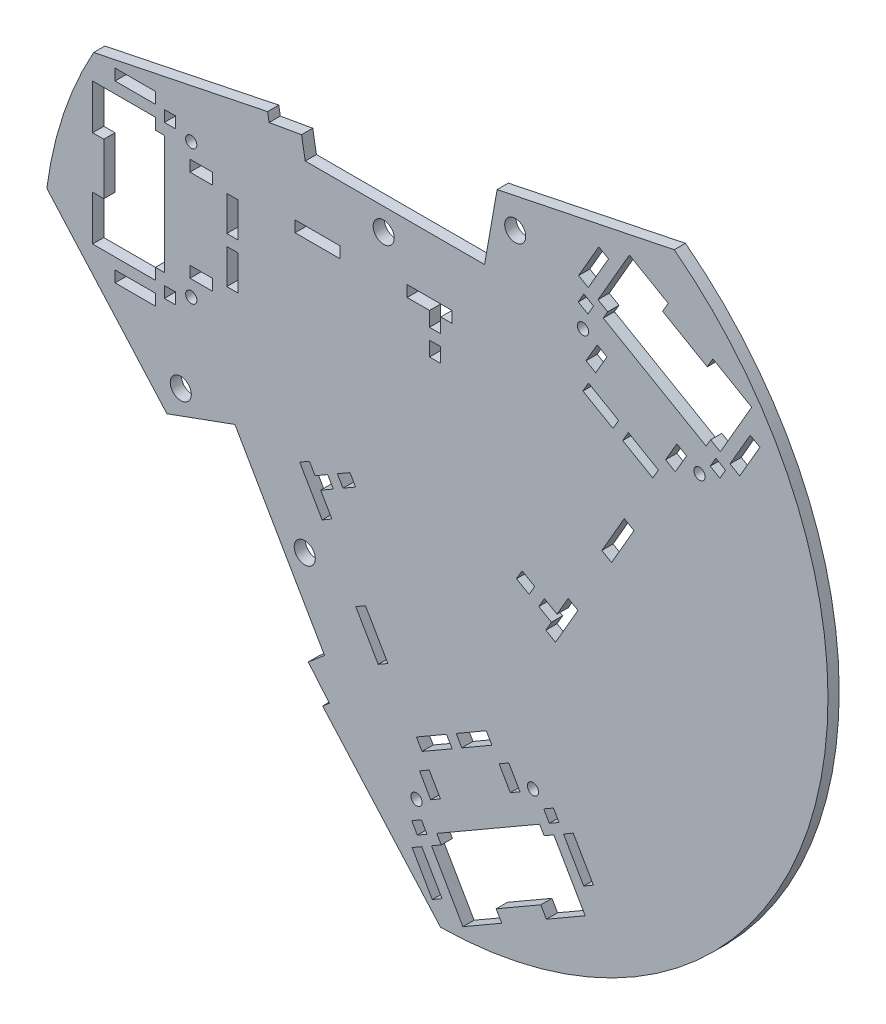
from build123d import *

# Parameters (mm, degrees)
ESQUISSE1_R             = 175
BOSS_EXTRU_1_DEPTH      = 5
ESQUISSE2_W             = 5
ESQUISSE2_H             = 6.5
ESQUISSE2_W_2           = 20
ESQUISSE2_H_2           = 5
ESQUISSE2_H_3           = 15.5
ESQUISSE2_W_3           = 10
ESQUISSE2_W_4           = 18
ESQUISSE2_H_4           = 20
ENL_V_MAT_EXTRU_1_DEPTH = 5
ENL_V_MAT_EXTRU_2_DEPTH = 5
ESQUISSE4_R             = 2.5
ENL_V_MAT_EXTRU_3_DEPTH = 5
ESQUISSE5_R             = 4.7
ENL_V_MAT_EXTRU_4_DEPTH = 5


with BuildPart() as part:
    # Esquisse1 → Boss.-Extru.1 (new body)
    with BuildSketch(Plane.XY):
        with Locations((148.080426897, -12.110171348)):
            Circle(ESQUISSE1_R)
    extrude(amount=BOSS_EXTRU_1_DEPTH)

    # Esquisse2 → Enlèv. mat.-Extru.1 (cut)
    with BuildSketch(Plane(origin=(0, 0, 0), x_dir=(-1, 0, 0), z_dir=(0, 0, -1))):
        Polygon((-155.311788567, 53.777441362), (-135.311788567, 53.777441362), (-135.311788567, 48.777441362), (-145.311788567, 48.777441362), (-145.311788567, 42.277441362), (-150.311788567, 42.277441362), (-150.311788567, 48.777441362), (-155.311788567, 48.777441362), align=None)
        with Locations((-147.811788567, 34.027441362)):
            Rectangle(ESQUISSE2_W, ESQUISSE2_H)
        with Locations((-95.311788567, 51.277441362)):
            Rectangle(ESQUISSE2_W_2, ESQUISSE2_H_2)
        with Locations((-57.36, 41.027441362)):
            Rectangle(ESQUISSE2_W, ESQUISSE2_H_3)
        with Locations((-57.36, 20.527441362)):
            Rectangle(ESQUISSE2_W, ESQUISSE2_H_3)
        with Locations((-43.43, 10.277441362)):
            Rectangle(ESQUISSE2_W_3, ESQUISSE2_H_2)
        with Locations((-29.5, -3.222558638)):
            Rectangle(ESQUISSE2_W, ESQUISSE2_H_2)
        with Locations((-14, -8.222558638)):
            Rectangle(ESQUISSE2_W_4, ESQUISSE2_H_2)
        with Locations((2.5, 9.277441362)):
            Rectangle(ESQUISSE2_W, ESQUISSE2_H_4)
        with Locations((2.5, 52.277441362)):
            Rectangle(ESQUISSE2_W, ESQUISSE2_H_4)
        with Locations((-14, 69.777441362)):
            Rectangle(ESQUISSE2_W_4, ESQUISSE2_H_2)
        with Locations((-29.5, 64.777441362)):
            Rectangle(ESQUISSE2_W, ESQUISSE2_H_2)
        with Locations((-43.43, 51.277441362)):
            Rectangle(ESQUISSE2_W_3, ESQUISSE2_H_2)
        Polygon((-87.404399659, -38.791434793), (-97.404399659, -56.111942869), (-101.734526678, -53.611942869), (-96.734526678, -44.951688831), (-102.363691803, -41.701688831), (-99.863691803, -37.371561812), (-94.234526678, -40.621561812), (-91.734526678, -36.291434793), align=None)
        Polygon((-104.193818822, -34.871561812), (-106.693818822, -39.201688831), (-112.322983946, -35.951688831), (-109.822983946, -31.621561812), align=None)
        Polygon((-112.404399659, -82.092704982), (-122.404399659, -99.413213058), (-126.734526678, -96.913213058), (-116.734526678, -79.592704982), align=None)
        Polygon((-139.460420962, -118.955108529), (-141.960420962, -123.285235548), (-155.38381472, -115.535235548), (-152.88381472, -111.205108529), align=None)
        Polygon((-157.213941739, -108.705108529), (-159.713941739, -113.035235548), (-173.137335498, -105.285235548), (-170.637335498, -100.955108529), align=None)
        Polygon((-176.352335498, -110.853778894), (-181.352335498, -119.514032932), (-185.682462517, -117.014032932), (-180.682462517, -108.353778894), align=None)
        Polygon((-196.258678449, -118.332576278), (-198.758678449, -122.662703297), (-203.088805468, -120.162703297), (-200.588805468, -115.832576278), align=None)
        Polygon((-205.088805468, -123.626804912), (-214.088805468, -139.215262181), (-218.418932487, -136.715262181), (-209.418932487, -121.126804912), align=None)
        Polygon((-212.258678449, -146.045389199), (-214.758678449, -150.375516218), (-197.438170373, -160.375516218), (-194.938170373, -156.045389199), align=None)
        Polygon((-175.019586086, -167.545389199), (-177.519586086, -171.875516218), (-160.199078011, -181.875516218), (-157.699078011, -177.545389199), align=None)
        Polygon((-141.868950992, -160.126804912), (-150.868950992, -175.715262181), (-146.538823973, -178.215262181), (-137.538823973, -162.626804912), align=None)
        Polygon((-139.868950992, -156.662703297), (-137.368950992, -152.332576278), (-141.699078011, -149.832576278), (-144.199078011, -154.162703297), align=None)
        Polygon((-145.845293943, -140.014032932), (-140.845293943, -131.353778894), (-145.175420962, -128.853778894), (-150.175420962, -137.514032932), align=None)
        Polygon((-201.525092463, -51.316520615), (-211.525092463, -33.996012539), (-207.194965444, -31.496012539), (-202.194965444, -40.156266577), (-196.56580032, -36.906266577), (-194.06580032, -41.236393596), (-199.694965444, -44.486393596), (-197.194965444, -48.816520615), align=None)
        Polygon((-189.735673301, -38.736393596), (-192.235673301, -34.406266577), (-186.606508176, -31.156266577), (-184.106508176, -35.486393596), align=None)
        Polygon((-226.525092463, -8.015250425), (-236.525092463, 9.30525765), (-232.194965444, 11.80525765), (-222.194965444, -5.515250425), align=None)
        Polygon((-244.920859728, 33.847153121), (-247.420859728, 38.17728014), (-233.997465969, 45.92728014), (-231.497465969, 41.597153121), align=None)
        Polygon((-227.16733895, 44.097153121), (-229.66733895, 48.42728014), (-216.243945192, 56.17728014), (-213.743945192, 51.847153121), align=None)
        Polygon((-219.458945192, 61.745823487), (-224.458945192, 70.406077524), (-220.128818173, 72.906077524), (-215.128818173, 64.245823487), align=None)
        Polygon((-215.982602241, 82.724620871), (-218.482602241, 87.05474789), (-214.152475222, 89.55474789), (-211.652475222, 85.224620871), align=None)
        Polygon((-216.152475222, 93.018849505), (-225.152475222, 108.607306773), (-220.822348203, 111.107306773), (-211.822348203, 95.518849505), align=None)
        Polygon((-231.982602241, 110.437433792), (-234.482602241, 114.767560811), (-251.803110316, 104.767560811), (-249.303110316, 100.437433792), align=None)
        Polygon((-269.221694603, 88.937433792), (-271.721694603, 93.267560811), (-289.042202679, 83.267560811), (-286.542202679, 78.937433792), align=None)
        Polygon((-279.372329698, 56.518849505), (-288.372329698, 72.107306773), (-292.702456717, 69.607306773), (-283.702456717, 54.018849505), align=None)
        Polygon((-277.372329698, 53.05474789), (-274.872329698, 48.724620871), (-270.542202679, 51.224620871), (-273.042202679, 55.55474789), align=None)
        Polygon((-259.965986747, 49.906077524), (-254.965986747, 41.245823487), (-250.635859728, 43.745823487), (-255.635859728, 52.406077524), align=None)
    extrude(amount=-ENL_V_MAT_EXTRU_1_DEPTH, mode=Mode.SUBTRACT)

    # Esquisse3 → Enlèv. mat.-Extru.2 (cut)
    with BuildSketch(Plane(origin=(0, 0, 0), x_dir=(-1, 0, 0), z_dir=(0, 0, -1))):
        Polygon((0, -0.722558638), (-23, -0.722558638), (-23, 4.277441362), (-27, 4.277441362), (-27, 57.277441362), (-23, 57.277441362), (-23, 62.277441362), (0, 62.277441362), align=None)
        Polygon((-212.258678449, -146.045389199), (-200.758678449, -126.126804912), (-196.42855143, -128.626804912), (-194.42855143, -125.162703297), (-148.52920503, -151.662703297), (-150.52920503, -155.126804912), (-146.199078011, -157.626804912), (-157.699078011, -177.545389199), align=None)
        Polygon((-231.982602241, 110.437433792), (-220.482602241, 90.518849505), (-224.81272926, 88.018849505), (-222.81272926, 84.55474789), (-268.71207566, 58.05474789), (-270.71207566, 61.518849505), (-275.042202679, 59.018849505), (-286.542202679, 78.937433792), align=None)
    extrude(amount=-ENL_V_MAT_EXTRU_2_DEPTH, mode=Mode.SUBTRACT)

    # Esquisse4 → Enlèv. mat.-Extru.3 (cut)
    with BuildSketch(Plane(origin=(0, 0, 0), x_dir=(-1, 0, 0), z_dir=(0, 0, -1))):
        with Locations((-39, 60.777441362)):
            Circle(ESQUISSE4_R)
        with Locations(Location((-39, 0.777441362, 0), (0, 0, 180))):
            Circle(ESQUISSE4_R)
        with Locations((-139.498116116, -143.020398452)):
            Circle(ESQUISSE4_R)
        with Locations(Location((-191.459640343, -113.020398452, 0), (0, 0, 180))):
            Circle(ESQUISSE4_R)
        with Locations((-265.743164573, 45.912443044)):
            Circle(ESQUISSE4_R)
        with Locations(Location((-213.781640346, 75.912443044, 0), (0, 0, 180))):
            Circle(ESQUISSE4_R)
    extrude(amount=-ENL_V_MAT_EXTRU_3_DEPTH, mode=Mode.SUBTRACT)

    # Esquisse5 → Enlèv. mat.-Extru.4 (cut)
    with BuildSketch(Plane(origin=(0, 0, 0), x_dir=(-1, 0, 0), z_dir=(0, 0, -1))):
        with Locations((-183.540805733, 98.777441362)):
            Circle(ESQUISSE5_R)
        with Locations((-124.86, 68.777441362)):
            Circle(ESQUISSE5_R)
        with Locations((-34.318747906, -36.844388804)):
            Circle(ESQUISSE5_R)
        with Locations((-89.639912886, -72.663457283)):
            Circle(ESQUISSE5_R)
        Polygon((14.513160249, 71.472297497), (-73.059583994, 89.489790677), (-73.747836164, 85.586518658), (-88.209738017, 88.136542147), (-89.86, 78.777441362), (-169.86, 78.777441362), (-175.463907457, 110.558779842), (-310.699358347, 138.382548929), (-285.787179808, 259.466421026), (39.425338788, 192.556169594), align=None)
        Polygon((-156.992679139, -194.711582732), (-97.602700211, -127.880108128), (-100.638906852, -125.332428255), (-91.199570804, -114.083065608), (-98.479658848, -107.974346415), (-58.479658848, -38.692314113), (-28.15425863, -49.729857134), (63.559557673, 53.475594286), (155.965177629, -28.640921241), (-64.587059183, -276.828098259), align=None)
    extrude(amount=-ENL_V_MAT_EXTRU_4_DEPTH, mode=Mode.SUBTRACT)


solid = part.part
